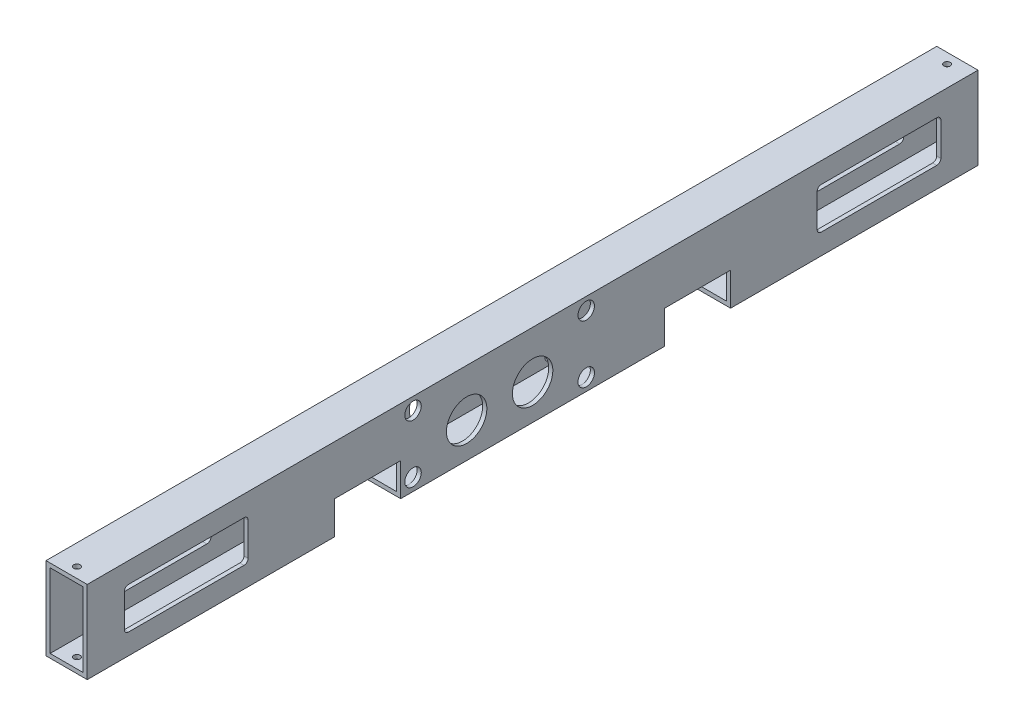
from build123d import *

# Parameters (mm, degrees)
SKETCH1_W                    = 31.75
SKETCH1_H                    = 63.5
SKETCH1_W_2                  = 25.4
SKETCH1_H_2                  = 57.15
BOSS_EXTRUDE1_DEPTH          = 685.8
CUT_EXTRUDE1_REACH           = 691.238
SKETCH3_W                    = 50.8
SKETCH3_H                    = 25.4
F_10_0_1935_DIAMETER_HOLE1_D = 4.9149
CUT_EXTRUDE2_REACH           = 691.238
SKETCH6_R                    = 15.5575
SKETCH6_R_2                  = 3.175
CUT_EXTRUDE3_REACH           = 691.238
SKETCH7_R                    = 6.35


with BuildPart() as part:
    # Sketch1 → Boss-Extrude1 (new body)
    with BuildSketch(Plane.XY):
        with Locations((3.710272719, -29.23968021)):
            Rectangle(SKETCH1_W, SKETCH1_H)
        with Locations((3.710272719, -29.23968021)):
            Rectangle(SKETCH1_W_2, SKETCH1_H_2, mode=Mode.SUBTRACT)
    extrude(amount=BOSS_EXTRUDE1_DEPTH)

    # Cut-Extrude1: up to this face of the body (flat: up to its plane)
    cut_extrude1_end = Plane(part.part.faces().sort_by_distance((19.585272719, -29.23968021, 342.9))[0])
    # Sketch3 → Cut-Extrude1 (cut, up to the picked face)
    with BuildSketch(Plane.ZY.offset(12.164727281), mode=Mode.PRIVATE) as cut_extrude1_sk1:
        with BuildLine():
            Line((31.7754, -13.36468021), (120.6754, -13.36468021))
            ThreePointArc((120.6754, -13.36468021), (122.92046403, -14.294616179), (123.8504, -16.53968021))
            Line((123.8504, -16.53968021), (123.8504, -41.93968021))
            ThreePointArc((123.8504, -41.93968021), (122.92046403, -44.18474424), (120.6754, -45.11468021))
            Line((120.6754, -45.11468021), (31.7754, -45.11468021))
            ThreePointArc((31.7754, -45.11468021), (29.53033597, -44.18474424), (28.6004, -41.93968021))
            Line((28.6004, -41.93968021), (28.6004, -16.53968021))
            ThreePointArc((28.6004, -16.53968021), (29.53033597, -14.294616179), (31.7754, -13.36468021))
        make_face()
    cut_extrude1_tool1 = split(extrude(cut_extrude1_sk1.sketch, amount=-CUT_EXTRUDE1_REACH, mode=Mode.PRIVATE), bisect_by=cut_extrude1_end, keep=Keep.BOTH, mode=Mode.PRIVATE)
    # Sketch3 → Cut-Extrude1 (cut, up to the picked face)
    with BuildSketch(Plane.ZY.offset(12.164727281), mode=Mode.PRIVATE) as cut_extrude1_sk2:
        with BuildLine():
            ThreePointArc((657.1996, -41.93968021), (656.26966403, -44.18474424), (654.0246, -45.11468021))
            Line((654.0246, -45.11468021), (565.1246, -45.11468021))
            ThreePointArc((565.1246, -45.11468021), (562.87953597, -44.18474424), (561.9496, -41.93968021))
            Line((561.9496, -41.93968021), (561.9496, -16.53968021))
            ThreePointArc((561.9496, -16.53968021), (562.87953597, -14.294616179), (565.1246, -13.36468021))
            Line((565.1246, -13.36468021), (654.0246, -13.36468021))
            ThreePointArc((654.0246, -13.36468021), (656.26966403, -14.294616179), (657.1996, -16.53968021))
            Line((657.1996, -16.53968021), (657.1996, -41.93968021))
        make_face()
    cut_extrude1_tool2 = split(extrude(cut_extrude1_sk2.sketch, amount=-CUT_EXTRUDE1_REACH, mode=Mode.PRIVATE), bisect_by=cut_extrude1_end, keep=Keep.BOTH, mode=Mode.PRIVATE)
    # Sketch3 → Cut-Extrude1 (cut, up to the picked face)
    with BuildSketch(Plane.ZY.offset(12.164727281), mode=Mode.PRIVATE) as cut_extrude1_sk3:
        with Locations((215.9, -48.28968021)):
            Rectangle(SKETCH3_W, SKETCH3_H)
    cut_extrude1_tool3 = split(extrude(cut_extrude1_sk3.sketch, amount=-CUT_EXTRUDE1_REACH, mode=Mode.PRIVATE), bisect_by=cut_extrude1_end, keep=Keep.BOTH, mode=Mode.PRIVATE)
    # Sketch3 → Cut-Extrude1 (cut, up to the picked face)
    with BuildSketch(Plane.ZY.offset(12.164727281), mode=Mode.PRIVATE) as cut_extrude1_sk4:
        with Locations((469.9, -48.28968021)):
            Rectangle(SKETCH3_W, SKETCH3_H)
    cut_extrude1_tool4 = split(extrude(cut_extrude1_sk4.sketch, amount=-CUT_EXTRUDE1_REACH, mode=Mode.PRIVATE), bisect_by=cut_extrude1_end, keep=Keep.BOTH, mode=Mode.PRIVATE)
    add(cut_extrude1_tool1.solids().sort_by(Axis((-12.164727, -29.23968, 76.2254), (1, 0, 0)))[0], mode=Mode.SUBTRACT)
    add(cut_extrude1_tool2.solids().sort_by(Axis((-12.164727, -29.23968, 609.5746), (1, 0, 0)))[0], mode=Mode.SUBTRACT)
    add(cut_extrude1_tool3.solids().sort_by(Axis((-12.164727, -48.28968, 215.9), (1, 0, 0)))[0], mode=Mode.SUBTRACT)
    add(cut_extrude1_tool4.solids().sort_by(Axis((-12.164727, -48.28968, 469.9), (1, 0, 0)))[0], mode=Mode.SUBTRACT)

    # #10 (0.1935) Diameter Hole1 (through all)
    with Locations(Plane(origin=(3.710272719, 2.51031979, 677.8625), x_dir=(1, 0, 0), z_dir=(0, 1, 0))):
        with Locations((0, 0), (0, 669.925)):
            Hole(F_10_0_1935_DIAMETER_HOLE1_D / 2)

    # Cut-Extrude2: up to this face of the body (flat: up to its plane)
    cut_extrude2_end = Plane(part.part.faces().sort_by_distance((-12.164727281, -27.832525424, 342.9))[0])
    # Sketch6 → Cut-Extrude2 (cut, up to the picked face)
    with BuildSketch(Plane(origin=(19.585272719, 0, 0), x_dir=(0, 0, -1), z_dir=(1, 0, 0)), mode=Mode.PRIVATE) as cut_extrude2_sk1:
        with Locations(Location((-342.9, -34.00218021, 0), (0, 0, 90))):
            Circle(SKETCH6_R)
    cut_extrude2_tool1 = split(extrude(cut_extrude2_sk1.sketch, amount=-CUT_EXTRUDE2_REACH, mode=Mode.PRIVATE), bisect_by=cut_extrude2_end, keep=Keep.BOTH, mode=Mode.PRIVATE)
    # Sketch6 → Cut-Extrude2 (cut, up to the picked face)
    with BuildSketch(Plane(origin=(19.585272719, 0, 0), x_dir=(0, 0, -1), z_dir=(1, 0, 0)), mode=Mode.PRIVATE) as cut_extrude2_sk2:
        with Locations(Location((-393.7, -34.00218021, 0), (0, 0, 90))):
            Circle(SKETCH6_R)
    cut_extrude2_tool2 = split(extrude(cut_extrude2_sk2.sketch, amount=-CUT_EXTRUDE2_REACH, mode=Mode.PRIVATE), bisect_by=cut_extrude2_end, keep=Keep.BOTH, mode=Mode.PRIVATE)
    # Sketch6 → Cut-Extrude2 (cut, up to the picked face)
    with BuildSketch(Plane(origin=(19.585272719, 0, 0), x_dir=(0, 0, -1), z_dir=(1, 0, 0)), mode=Mode.PRIVATE) as cut_extrude2_sk3:
        with Locations(Location((-434.975, -7.01468021, 0), (0, 0, 90))):
            Circle(SKETCH6_R_2)
    cut_extrude2_tool3 = split(extrude(cut_extrude2_sk3.sketch, amount=-CUT_EXTRUDE2_REACH, mode=Mode.PRIVATE), bisect_by=cut_extrude2_end, keep=Keep.BOTH, mode=Mode.PRIVATE)
    # Sketch6 → Cut-Extrude2 (cut, up to the picked face)
    with BuildSketch(Plane(origin=(19.585272719, 0, 0), x_dir=(0, 0, -1), z_dir=(1, 0, 0)), mode=Mode.PRIVATE) as cut_extrude2_sk4:
        with Locations(Location((-301.625, -7.01468021, 0), (0, 0, 90))):
            Circle(SKETCH6_R_2)
    cut_extrude2_tool4 = split(extrude(cut_extrude2_sk4.sketch, amount=-CUT_EXTRUDE2_REACH, mode=Mode.PRIVATE), bisect_by=cut_extrude2_end, keep=Keep.BOTH, mode=Mode.PRIVATE)
    # Sketch6 → Cut-Extrude2 (cut, up to the picked face)
    with BuildSketch(Plane(origin=(19.585272719, 0, 0), x_dir=(0, 0, -1), z_dir=(1, 0, 0)), mode=Mode.PRIVATE) as cut_extrude2_sk5:
        with Locations(Location((-434.975, -51.46468021, 0), (0, 0, 90))):
            Circle(SKETCH6_R_2)
    cut_extrude2_tool5 = split(extrude(cut_extrude2_sk5.sketch, amount=-CUT_EXTRUDE2_REACH, mode=Mode.PRIVATE), bisect_by=cut_extrude2_end, keep=Keep.BOTH, mode=Mode.PRIVATE)
    # Sketch6 → Cut-Extrude2 (cut, up to the picked face)
    with BuildSketch(Plane(origin=(19.585272719, 0, 0), x_dir=(0, 0, -1), z_dir=(1, 0, 0)), mode=Mode.PRIVATE) as cut_extrude2_sk6:
        with Locations(Location((-301.625, -51.46468021, 0), (0, 0, 90))):
            Circle(SKETCH6_R_2)
    cut_extrude2_tool6 = split(extrude(cut_extrude2_sk6.sketch, amount=-CUT_EXTRUDE2_REACH, mode=Mode.PRIVATE), bisect_by=cut_extrude2_end, keep=Keep.BOTH, mode=Mode.PRIVATE)
    add(cut_extrude2_tool1.solids().sort_by(Axis((19.585273, -34.00218, 342.9), (-1, 0, 0)))[0], mode=Mode.SUBTRACT)
    add(cut_extrude2_tool2.solids().sort_by(Axis((19.585273, -34.00218, 393.7), (-1, 0, 0)))[0], mode=Mode.SUBTRACT)
    add(cut_extrude2_tool3.solids().sort_by(Axis((19.585273, -7.01468, 434.975), (-1, 0, 0)))[0], mode=Mode.SUBTRACT)
    add(cut_extrude2_tool4.solids().sort_by(Axis((19.585273, -7.01468, 301.625), (-1, 0, 0)))[0], mode=Mode.SUBTRACT)
    add(cut_extrude2_tool5.solids().sort_by(Axis((19.585273, -51.46468, 434.975), (-1, 0, 0)))[0], mode=Mode.SUBTRACT)
    add(cut_extrude2_tool6.solids().sort_by(Axis((19.585273, -51.46468, 301.625), (-1, 0, 0)))[0], mode=Mode.SUBTRACT)

    # Sketch7 → Cut-Extrude3 (cut, up to next)
    with BuildSketch(Plane(origin=(19.585272719, 0, 0), x_dir=(0, 0, -1), z_dir=(1, 0, 0)), mode=Mode.PRIVATE) as cut_extrude3_sk1:
        with Locations(Location((-434.975, -7.01468021, 0), (0, 0, 90))):
            Circle(SKETCH7_R)
    cut_extrude3_tool1 = extrude(cut_extrude3_sk1.sketch, amount=-CUT_EXTRUDE3_REACH, mode=Mode.PRIVATE) & part.part
    # Sketch7 → Cut-Extrude3 (cut, up to next)
    with BuildSketch(Plane(origin=(19.585272719, 0, 0), x_dir=(0, 0, -1), z_dir=(1, 0, 0)), mode=Mode.PRIVATE) as cut_extrude3_sk2:
        with Locations(Location((-434.975, -51.46468021, 0), (0, 0, 90))):
            Circle(SKETCH7_R)
    cut_extrude3_tool2 = extrude(cut_extrude3_sk2.sketch, amount=-CUT_EXTRUDE3_REACH, mode=Mode.PRIVATE) & part.part
    # Sketch7 → Cut-Extrude3 (cut, up to next)
    with BuildSketch(Plane(origin=(19.585272719, 0, 0), x_dir=(0, 0, -1), z_dir=(1, 0, 0)), mode=Mode.PRIVATE) as cut_extrude3_sk3:
        with Locations(Location((-301.625, -51.46468021, 0), (0, 0, 90))):
            Circle(SKETCH7_R)
    cut_extrude3_tool3 = extrude(cut_extrude3_sk3.sketch, amount=-CUT_EXTRUDE3_REACH, mode=Mode.PRIVATE) & part.part
    # Sketch7 → Cut-Extrude3 (cut, up to next)
    with BuildSketch(Plane(origin=(19.585272719, 0, 0), x_dir=(0, 0, -1), z_dir=(1, 0, 0)), mode=Mode.PRIVATE) as cut_extrude3_sk4:
        with Locations(Location((-301.625, -7.01468021, 0), (0, 0, 90))):
            Circle(SKETCH7_R)
    cut_extrude3_tool4 = extrude(cut_extrude3_sk4.sketch, amount=-CUT_EXTRUDE3_REACH, mode=Mode.PRIVATE) & part.part
    add(cut_extrude3_tool1.solids().sort_by_distance((19.585273, -7.01468, 434.975))[0], mode=Mode.SUBTRACT)
    add(cut_extrude3_tool2.solids().sort_by_distance((19.585273, -51.46468, 434.975))[0], mode=Mode.SUBTRACT)
    add(cut_extrude3_tool3.solids().sort_by_distance((19.585273, -51.46468, 301.625))[0], mode=Mode.SUBTRACT)
    add(cut_extrude3_tool4.solids().sort_by_distance((19.585273, -7.01468, 301.625))[0], mode=Mode.SUBTRACT)


solid = part.part
